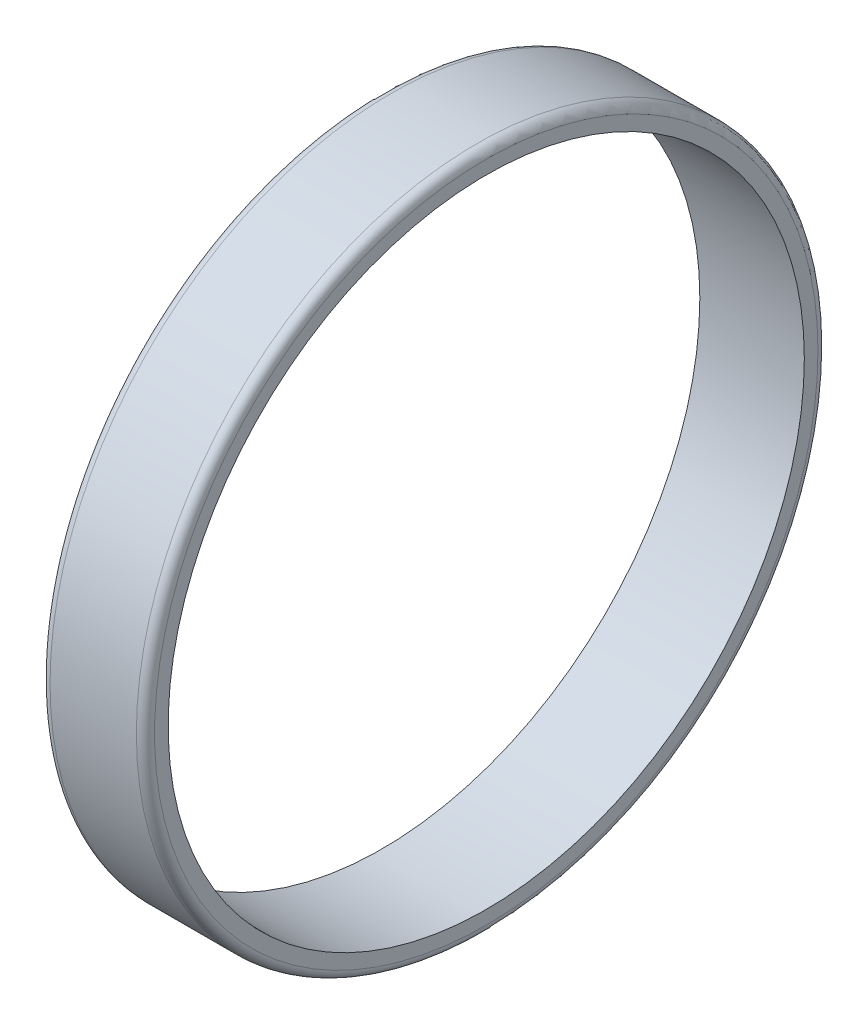
from build123d import *

# Parameters (mm, degrees)
SKETCH_1_R      = 37.5
SKETCH_1_R_2    = 35
EXTRUDE_1_DEPTH = 11.5
FILLET_1_R      = 1


with BuildPart() as part:
    # Эскиз1 → Бобышка-Вытянуть1 (new body)
    with BuildSketch(Plane(origin=(0, 0, 0), x_dir=(0, 0, -1), z_dir=(1, 0, 0))):
        Circle(SKETCH_1_R)
        Circle(SKETCH_1_R_2, mode=Mode.SUBTRACT)
    extrude(amount=EXTRUDE_1_DEPTH)

    # Скругление1
    fillet_1_edges = [part.edges().sort_by_distance(p)[0] for p in [
        (0, 0, 37.5),
        (11.5, 0, 37.5),
    ]]
    fillet(fillet_1_edges, radius=FILLET_1_R)


solid = part.part
